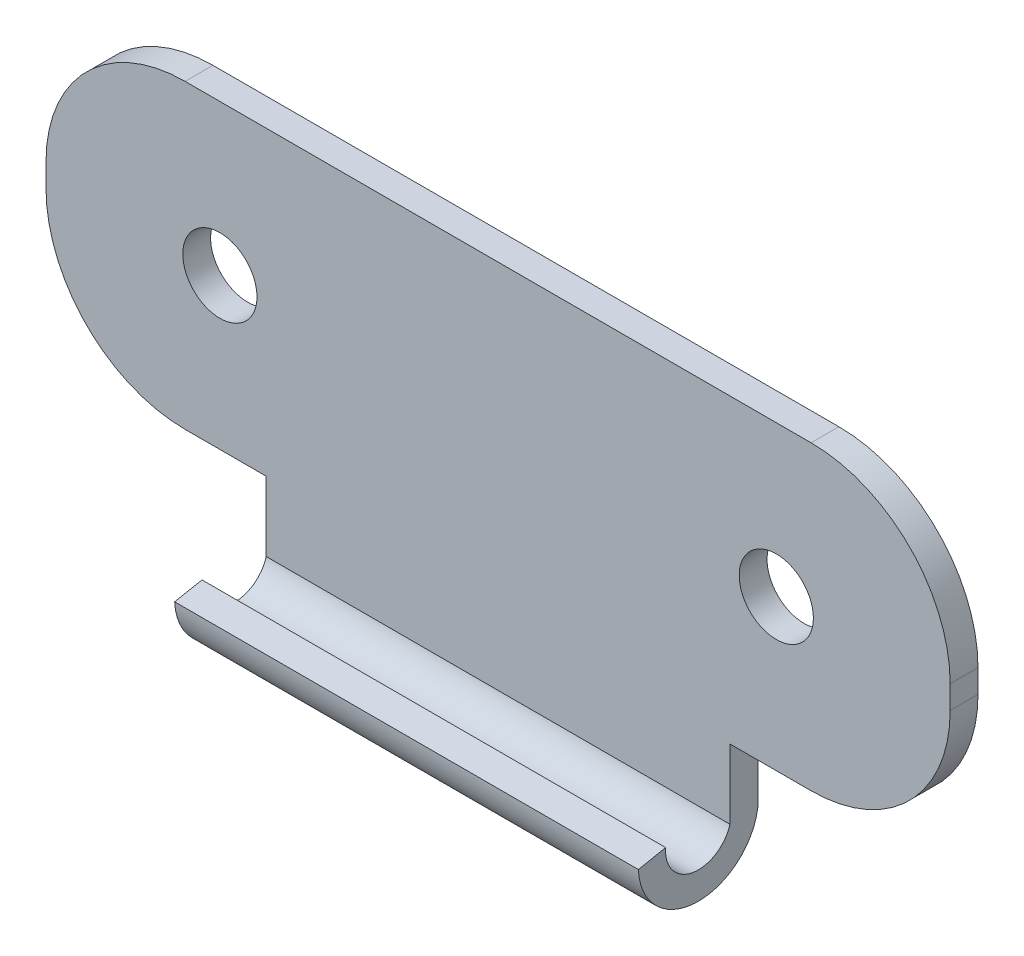
from build123d import *

# Parameters (mm, degrees)
EXTRUDE_1_DEPTH     = 1.2
SKETCH_2_R          = 1.6
CUT_EXTRUDE_1_DEPTH = 1.2
SKETCH_4_W          = 20
SKETCH_4_H          = 1.2


with BuildPart() as part:
    # 草图1 → 凸台-拉伸1 (new body)
    with BuildSketch(Plane.XY):
        with BuildLine():
            Line((7.478060046, -4.57852194), (10.978060046, -4.57852194))
            ThreePointArc((10.978060046, -4.57852194), (15.220700733, -2.821162627), (16.978060046, 1.42147806))
            Line((16.978060046, 1.42147806), (16.978060046, 2.42147806))
            ThreePointArc((16.978060046, 2.42147806), (15.220700733, 6.664118747), (10.978060046, 8.42147806))
            Line((10.978060046, 8.42147806), (-16.021939954, 8.42147806))
            ThreePointArc((-16.021939954, 8.42147806), (-20.264580641, 6.664118747), (-22.021939954, 2.42147806))
            Line((-22.021939954, 2.42147806), (-22.021939954, 1.42147806))
            ThreePointArc((-22.021939954, 1.42147806), (-20.264580641, -2.821162627), (-16.021939954, -4.57852194))
            Line((-16.021939954, -4.57852194), (-12.521939954, -4.57852194))
            Line((-12.521939954, -4.57852194), (-12.521939954, -7.57852194))
            Line((-12.521939954, -7.57852194), (7.478060046, -7.57852194))
            Line((7.478060046, -7.57852194), (7.478060046, -4.57852194))
        make_face()
    extrude(amount=EXTRUDE_1_DEPTH)

    # 草图2 → 切除-拉伸1 (cut)
    with BuildSketch(Plane.XY.offset(1.2)):
        with Locations((-14.521939954, 1.92147806)):
            Circle(SKETCH_2_R)
        with Locations((9.478060046, 1.92147806)):
            Circle(SKETCH_2_R)
    extrude(amount=-CUT_EXTRUDE_1_DEPTH, mode=Mode.SUBTRACT)

    # 扫描1: sweep along a path in 草图3
    with BuildLine(Plane.ZY.offset(12.521939954)) as sweep_1_path:
        ThreePointArc((0.6, -7.57852194), (2.762027547, -9.176177297), (4.561146836, -7.178669966))
    # 草图4 → 扫描1 (sweep)
    with BuildSketch(Plane.XZ.offset(7.57852194)):
        with Locations((-2.521939954, 0.6)):
            Rectangle(SKETCH_4_W, SKETCH_4_H)
    sweep(path=sweep_1_path.line)


solid = part.part
